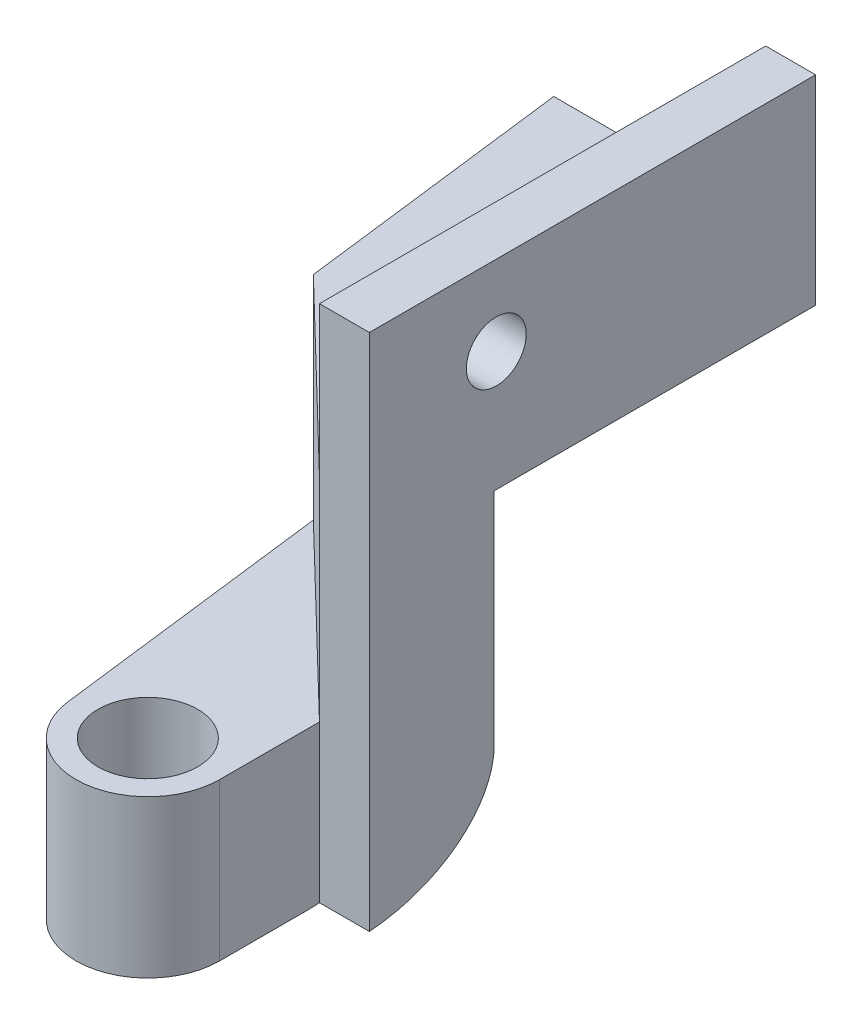
from build123d import *

# Parameters (mm, degrees)
CROQUIS1_R              = 1.5
SALIENTE_EXTRUIR1_DEPTH = 2.5
SALIENTE_EXTRUIR2_START = -10.65
CROQUIS1_4_R            = 2.5
SALIENTE_EXTRUIR2_DEPTH = 7.87
SALIENTE_EXTRUIR3_DEPTH = 18.52
REDONDEO1_R             = 5
CROQUIS3_W              = 22.36
CROQUIS3_H              = 7.5
CROQUIS3_R              = 1.5
SALIENTE_EXTRUIR4_DEPTH = 2.5


with BuildPart() as part:
    # Croquis1 → Saliente-Extruir1 (new body)
    # profile 1 of 2: a face of its own
    with BuildSketch(Plane(origin=(0, 0, 0), x_dir=(1, 0, 0), z_dir=(0, 1, 0))):
        Polygon((3.6, 27.36), (-7.02, 27.36), (-6.196167881, 20.715785518), (3.6, 11.25573616), align=None)
        with Locations(Location((-0.4, 21.36, 0), (0, 0, 270))):
            Circle(CROQUIS1_R, mode=Mode.SUBTRACT)
    # profile 2 of 2: a face of its own
    with BuildSketch(Plane(origin=(0, 0, 0), x_dir=(1, 0, 0), z_dir=(0, 1, 0))):
        Polygon((3.6, 11.25573616), (-6.196167881, 20.715785518), (-5.314994069, 13.6091097), (3.6, 5), align=None)
    extrude(amount=-SALIENTE_EXTRUIR1_DEPTH)



with BuildPart() as body_2:
    # Croquis1<4> → Saliente-Extruir2 (new body)
    with BuildSketch(Plane(origin=(0, 0, 0), x_dir=(1, 0, 0), z_dir=(0, 1, 0)).offset(SALIENTE_EXTRUIR2_START)):
        with BuildLine():
            Line((3.6, 5), (-5.314994069, 13.6091097))
            Line((-5.314994069, 13.6091097), (-3.572641648, -0.442980423))
            ThreePointArc((-3.572641648, -0.442980423), (0.221912221, -3.593153902), (3.6, 0))
            Line((3.6, 0), (3.6, 5))
        make_face()
        with Locations(Location((0, 0, 0), (0, 0, 270))):
            Circle(CROQUIS1_4_R, mode=Mode.SUBTRACT)
    extrude(amount=-SALIENTE_EXTRUIR2_DEPTH)


with BuildPart() as part_1:
    add(part.part)

    add(body_2.part)  # Saliente-Extruir3 merges body 2
    # Croquis1<5> → Saliente-Extruir3 (add)
    with BuildSketch(Plane(origin=(0, 0, 0), x_dir=(1, 0, 0), z_dir=(0, 1, 0))):
        Polygon((3.6, 11.25573616), (-6.196167881, 20.715785518), (-5.314994069, 13.6091097), (3.6, 5), align=None)
    extrude(amount=-SALIENTE_EXTRUIR3_DEPTH)

    # Redondeo1
    redondeo1_edges = [part_1.edges().sort_by_distance(p)[0] for p in [
        (-1.29808394, -18.52, -15.985760839),
    ]]
    fillet(redondeo1_edges, radius=REDONDEO1_R)

    # Croquis3 → Saliente-Extruir4 (add)
    # profile 1 of 2: a face of its own
    with BuildSketch(Plane(origin=(3.6, 0, 0), x_dir=(0, 0, -1), z_dir=(1, 0, 0))):
        with BuildLine():
            Line((5, 0), (5, -10.65))
            Line((5, -10.65), (5, -18.494937186))
            add(Edge.make_bspline(
                [(5, -18.494937186), (11.25573616, -18.042670169), (11.25573616, -13.52)],
                knots=[4.821475205, 4.821475205, 4.821475205, 6.283185307, 6.283185307, 6.283185307], degree=2, weights=[0.962144349, 0.727447175, 1]))
            Line((11.25573616, -13.52), (11.25573616, -2.5))
            Line((11.25573616, -2.5), (27.36, -2.5))
            Line((27.36, -2.5), (27.36, 0))
            Line((27.36, 0), (5, 0))
        make_face()
    # profile 2 of 2: a face of its own
    with BuildSketch(Plane(origin=(3.6, 0, 0), x_dir=(0, 0, -1), z_dir=(1, 0, 0))):
        with Locations((16.18, 3.75)):
            Rectangle(CROQUIS3_W, CROQUIS3_H)
        with Locations((11.36, 3.5)):
            Circle(CROQUIS3_R, mode=Mode.SUBTRACT)
    extrude(amount=SALIENTE_EXTRUIR4_DEPTH)


solid = part_1.part
